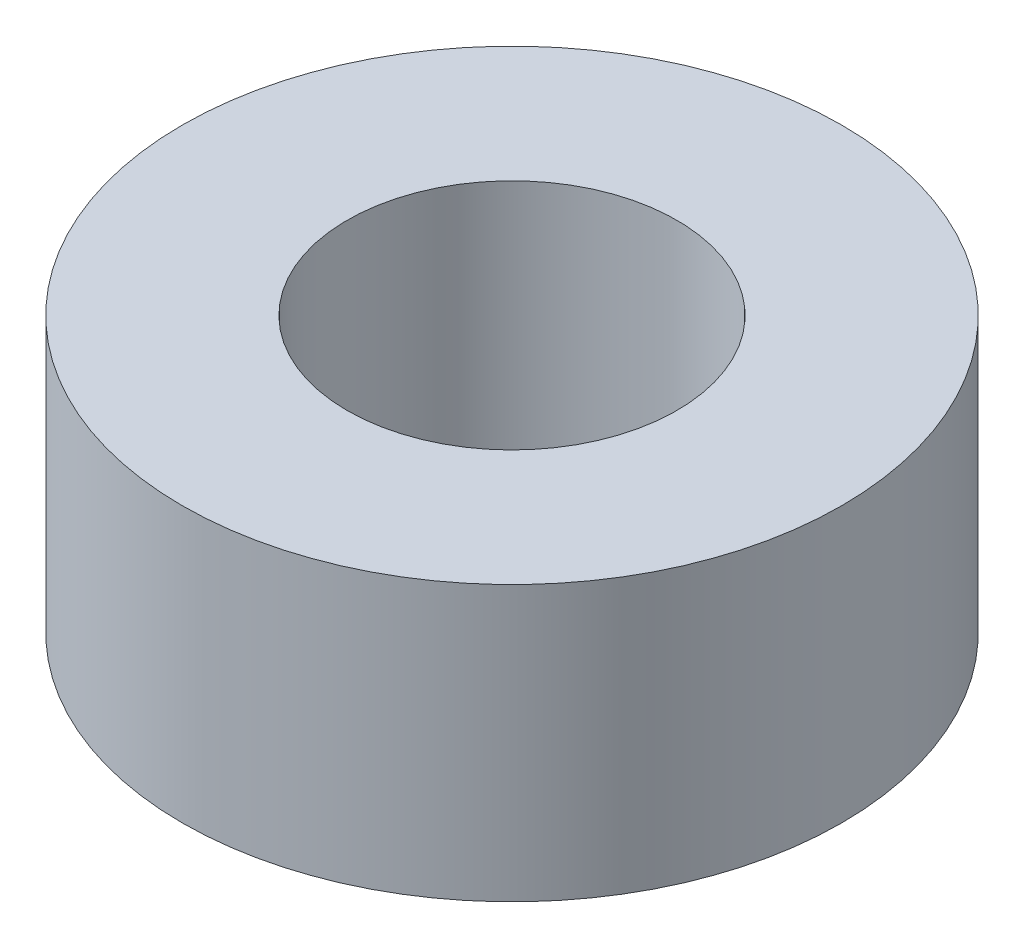
from build123d import *

# Parameters (mm, degrees)
SKETCH_1_R      = 3
SKETCH_1_R_2    = 1.5
EXTRUDE_1_DEPTH = 2.5


with BuildPart() as part:
    # 草图1 → 凸台-拉伸1 (new body)
    with BuildSketch(Plane(origin=(0, 0, 0), x_dir=(1, 0, 0), z_dir=(0, 1, 0))):
        with Locations(Location((0, 0, 0), (0, 0, 270))):
            Circle(SKETCH_1_R)
        with Locations(Location((0, 0, 0), (0, 0, 270))):
            Circle(SKETCH_1_R_2, mode=Mode.SUBTRACT)
    extrude(amount=EXTRUDE_1_DEPTH)


solid = part.part
